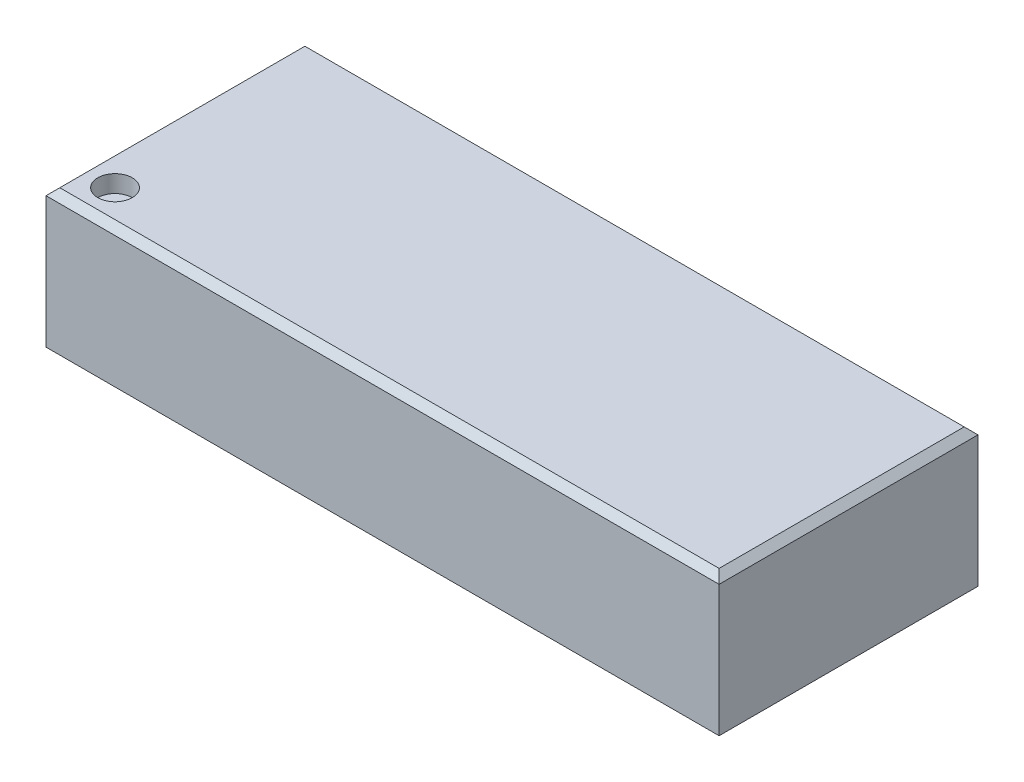
from build123d import *

# Parameters (mm, degrees)
ESQUISSE1_W             = 9.75
ESQUISSE1_H             = 3.75
BOSS_EXTRU_1_DEPTH      = 2
ESQUISSE2_R             = 0.25
ENL_V_MAT_EXTRU_1_DEPTH = 0.25
CHANFREIN1_SIZE         = 0.1


with BuildPart() as part:
    # Esquisse1 → Boss.-Extru.1 (new body)
    with BuildSketch(Plane(origin=(0, 0, 0), x_dir=(1, 0, 0), z_dir=(0, 1, 0))):
        Rectangle(ESQUISSE1_W, ESQUISSE1_H)
    extrude(amount=BOSS_EXTRU_1_DEPTH)

    # Esquisse2 → Enlèv. mat.-Extru.1 (cut)
    with BuildSketch(Plane(origin=(0, 2, 0), x_dir=(1, 0, 0), z_dir=(0, 1, 0))):
        with Locations(Location((-4.375, -1.375, 0), (0, 0, 270))):
            Circle(ESQUISSE2_R)
    extrude(amount=-ENL_V_MAT_EXTRU_1_DEPTH, mode=Mode.SUBTRACT)

    # Chanfrein1
    chanfrein1_edges = [part.edges().sort_by_distance(p)[0] for p in [
        (4.875, 2, 0),
        (0, 2, -1.875),
        (-4.875, 2, 0),
        (0, 2, 1.875),
    ]]
    chamfer(chanfrein1_edges, length=CHANFREIN1_SIZE)


solid = part.part
